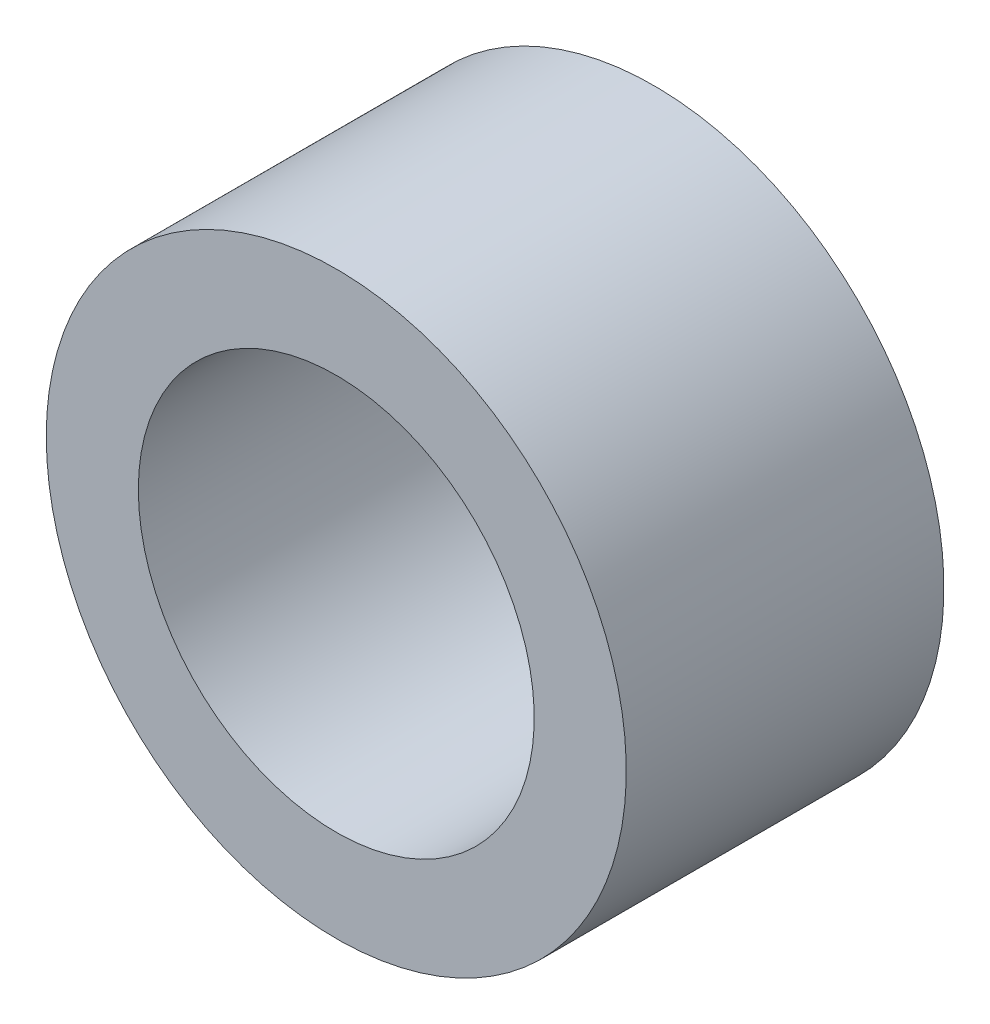
from build123d import *

# Parameters (mm, degrees)
SKETCH1_R           = 3.15
SKETCH1_R_2         = 2.15
BOSS_EXTRUDE1_DEPTH = 3.45


with BuildPart() as part:
    # Sketch1 → Boss-Extrude1 (new body)
    with BuildSketch(Plane.XY):
        with Locations(Location((0, 0, 0), (0, 0, 180))):
            Circle(SKETCH1_R)
        with Locations(Location((0, 0, 0), (0, 0, 180))):
            Circle(SKETCH1_R_2, mode=Mode.SUBTRACT)
    extrude(amount=BOSS_EXTRUDE1_DEPTH)


solid = part.part
